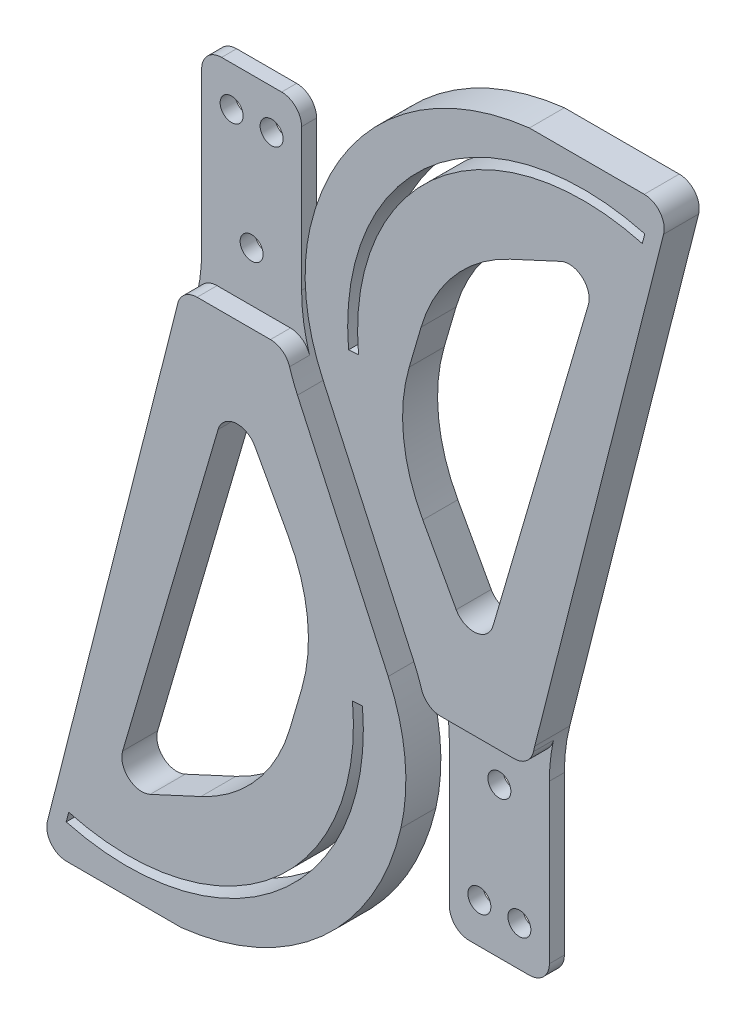
from build123d import *

# Parameters (mm, degrees)
SKETCH1_R          = 2.3
EXTRUDE1_DEPTH     = 7
FILLET1_R          = 39
FILLET2_R          = 33
FILLET3_R          = 4
FILLET4_R          = 35
SKETCH2_W          = 32.945688526
SKETCH2_H          = 40
CUT_EXTRUDE1_DEPTH = 4
FILLET5_R          = 4
SKETCH3_R          = 1.199933633
EXTRUDE2_DEPTH     = 0.1
CIRPATTERN1_COUNT  = 2


with BuildPart() as part:
    # Sketch1 → Extrude1 (new body)
    with BuildSketch(Plane.XY):
        with BuildLine():
            Line((-10, 0), (-10, 40))
            Line((-10, 40), (-34.835050164, 94.26528975))
            ThreePointArc((-34.835050164, 94.26528975), (-24.125651083, 131.816849255), (10, 150.797122912))
            Line((10, 150.797122912), (38.123036173, 150.797122912))
            Line((38.123036173, 150.797122912), (10, 40))
            Line((10, 40), (10, 0))
            Line((10, 0), (-10, 0))
        make_face()
        with Locations((0, 30)):
            Circle(SKETCH1_R, mode=Mode.SUBTRACT)
        with Locations((4, 8)):
            Circle(SKETCH1_R, mode=Mode.SUBTRACT)
        with Locations((-4, 8)):
            Circle(SKETCH1_R, mode=Mode.SUBTRACT)
        Polygon((24.273596224, 134.519949949), (0, 51.555620572), (-17.877283618, 84.220450394), (-7.457593377, 119.833740044), align=None, mode=Mode.SUBTRACT)
        with BuildLine():
            Line((32.581459881, 142.069152681), (33.097875117, 144.001331581))
            ThreePointArc((33.097875117, 144.001331581), (-9.474149394, 134.549204992), (-26.175231417, 94.26528975))
            Line((-26.175231417, 94.26528975), (-24.182732091, 94.438340134))
            ThreePointArc((-24.182732091, 94.438340134), (-8.246919268, 133.086649081), (32.581459881, 142.069152681))
        make_face(mode=Mode.SUBTRACT)
    extrude(amount=EXTRUDE1_DEPTH)

    # Fillet1
    fillet1_edges = [part.edges().sort_by_distance(p)[0] for p in [
        (-34.835050164, 94.26528975, 3.5),
    ]]
    fillet(fillet1_edges, radius=FILLET1_R)

    # Fillet2
    fillet2_edges = [part.edges().sort_by_distance(p)[0] for p in [
        (-17.877283618, 84.220450394, 3.5),
        (-7.457593377, 119.833740044, 3.5),
    ]]
    fillet(fillet2_edges, radius=FILLET2_R)

    # Fillet3
    fillet3_edges = [part.edges().sort_by_distance(p)[0] for p in [
        (-10, 0, 3.5),
        (10, 0, 3.5),
        (0, 51.555620572, 3.5),
        (24.273596224, 134.519949949, 3.5),
        (38.123036173, 150.797122912, 3.5),
    ]]
    fillet(fillet3_edges, radius=FILLET3_R)

    # Fillet4
    fillet4_edges = [part.edges().sort_by_distance(p)[0] for p in [
        (-10, 40, 3.5),
        (10, 40, 3.5),
    ]]
    fillet(fillet4_edges, radius=FILLET4_R)

    # Sketch2 → Cut-Extrude1 (cut)
    with BuildSketch(Plane.XY.offset(7)):
        with Locations((-0.117072908, 20)):
            Rectangle(SKETCH2_W, SKETCH2_H)
    extrude(amount=-CUT_EXTRUDE1_DEPTH, mode=Mode.SUBTRACT)

    # Fillet5
    fillet5_edges = [part.edges().sort_by_distance(p)[0] for p in [
        (-10.841473657, 40, 5),
        (10.274211948, 40, 5),
    ]]
    fillet(fillet5_edges, radius=FILLET5_R)


with BuildPart() as body_2:
    # Sketch3 → Extrude2 (new body)
    with BuildSketch(Plane.XY):
        with Locations((-24.781808942, 64.121830884)):
            Circle(SKETCH3_R)
    extrude(amount=EXTRUDE2_DEPTH)


with BuildPart() as cirpattern1_1:
    # CirPattern1: pattern copy
    add(part.part.rotate(Axis((-24.781808942, 64.121830884, 0.1), (0, 0, -1)), 1 * 360 / CIRPATTERN1_COUNT))


solid = Compound([part.part, body_2.part, cirpattern1_1.part])
